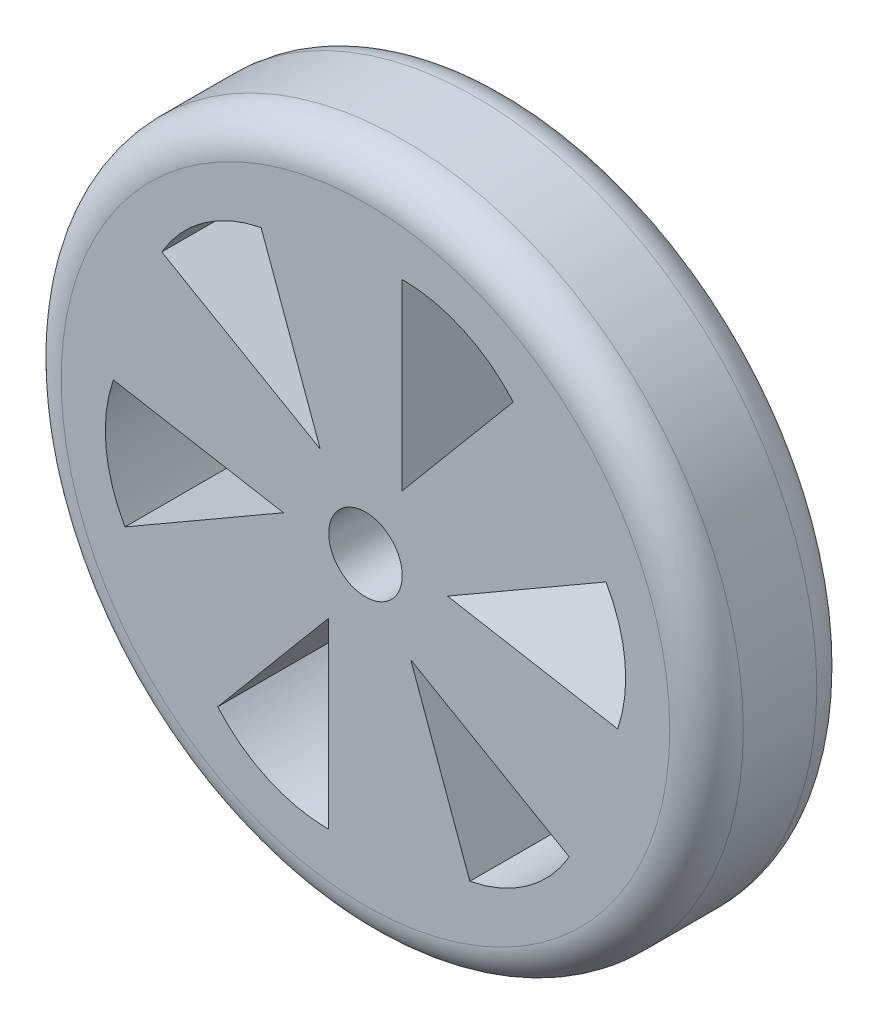
from build123d import *

# Parameters (mm, degrees)
SKETCH1_R           = 46.395094555
BOSS_EXTRUDE1_DEPTH = 20
FILLET1_R           = 5
SKETCH2_R           = 5
CUT_EXTRUDE1_DEPTH  = 69.593072653
CUT_EXTRUDE2_DEPTH  = 69.593072653


with BuildPart() as part:
    # Sketch1 → Boss-Extrude1 (new body)
    with BuildSketch(Plane.XY):
        Circle(SKETCH1_R)
    extrude(amount=BOSS_EXTRUDE1_DEPTH)

    # Fillet1
    fillet1_edges = [part.edges().sort_by_distance(p)[0] for p in [
        (-46.395094555, 0, 0),
        (-46.395094555, 0, 20),
    ]]
    fillet(fillet1_edges, radius=FILLET1_R)

    # Sketch2 → Cut-Extrude1 (cut, through all)
    with BuildSketch(Plane.XY.offset(20)):
        Circle(SKETCH2_R)
    extrude(amount=-CUT_EXTRUDE1_DEPTH, mode=Mode.SUBTRACT)

    # Sketch3 → Cut-Extrude2 (cut, through all)
    with BuildSketch(Plane.XY.offset(20)):
        with BuildLine():
            Line((5, 10), (5, 34.891061086))
            ThreePointArc((5, 34.891061086), (13.300877708, 33.087088929), (20.104300189, 28.000604014))
            Line((20.104300189, 28.000604014), (5, 10))
        make_face()
        with BuildLine():
            Line((34.301384492, -3.410532682), (11.160254038, 0.669872981))
            Line((11.160254038, 0.669872981), (32.716545265, 13.115403524))
            ThreePointArc((32.716545265, 13.115403524), (35.304698404, 5.024646477), (34.301384492, -3.410532682))
        make_face()
        with BuildLine():
            Line((14.197084303, -31.411136696), (6.160254038, -9.330127019))
            Line((6.160254038, -9.330127019), (27.716545265, -21.775657562))
            ThreePointArc((27.716545265, -21.775657562), (22.003820696, -28.062442452), (14.197084303, -31.411136696))
        make_face()
        with BuildLine():
            Line((-20.104300189, -28.000604014), (-5, -10))
            Line((-5, -10), (-5, -34.891061086))
            ThreePointArc((-5, -34.891061086), (-13.300877708, -33.087088929), (-20.104300189, -28.000604014))
        make_face()
        with BuildLine():
            Line((-34.301384492, 3.410532682), (-11.160254038, -0.669872981))
            Line((-11.160254038, -0.669872981), (-32.716545265, -13.115403524))
            ThreePointArc((-32.716545265, -13.115403524), (-35.304698404, -5.024646477), (-34.301384492, 3.410532682))
        make_face()
        with BuildLine():
            Line((-14.197084303, 31.411136696), (-6.160254038, 9.330127019))
            Line((-6.160254038, 9.330127019), (-27.716545265, 21.775657562))
            ThreePointArc((-27.716545265, 21.775657562), (-22.003820696, 28.062442452), (-14.197084303, 31.411136696))
        make_face()
    extrude(amount=-CUT_EXTRUDE2_DEPTH, mode=Mode.SUBTRACT)


solid = part.part
